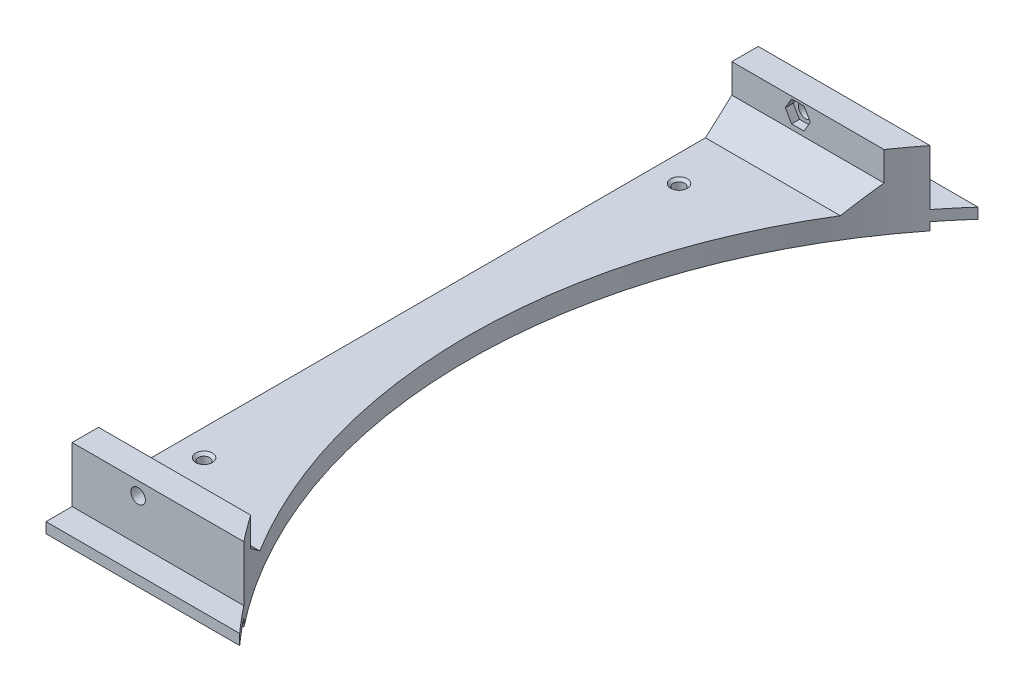
from build123d import *

# Parameters (mm, degrees)
SKETCH1_W                = 650
SKETCH1_H                = 650
BOSS_EXTRUDE1_DEPTH      = 8
BOSS_EXTRUDE2_DEPTH      = 650
CUT_EXTRUDE2_DEPTH       = 921.277302922
CUT_EXTRUDE2_DEPTH_BACK  = 921.277302922
SKETCH4_R                = 11
CUT_EXTRUDE1_DEPTH       = 920.932062709
CUT_EXTRUDE1_DEPTH_BACK  = 920.932062709
SKETCH2_R                = 210
CUT_EXTRUDE3_DEPTH       = 921.277302998
CUT_EXTRUDE3_DEPTH_BACK  = 110
CUT_EXTRUDE4_DEPTH       = 110
CUT_EXTRUDE5_DEPTH       = 920.932062713
CUT_EXTRUDE5_DEPTH_BACK  = 920.932062713
SKETCH7_OUTSIDE_W        = 836.056
SKETCH7_OUTSIDE_H        = 836.056
BOSS_EXTRUDE3_DEPTH      = 170
SKETCH11_W               = 9.9
SKETCH11_H               = 4
BOSS_EXTRUDE4_DEPTH      = 170
CUT_EXTRUDE7_DEPTH       = 496.410950626
CUT_EXTRUDE7_DEPTH_BACK  = 496.410950626
SKETCH10_R               = 210
CUT_EXTRUDE8_DEPTH       = 320.349035711
CUT_EXTRUDE8_DEPTH_BACK  = 320.349035711
SKETCH12_R               = 2.75
SKETCH12_R_2             = 2.2
CUT_EXTRUDE9_DEPTH       = 495.859380642
CUT_EXTRUDE9_DEPTH_BACK  = 495.859380642
SKETCH13_W               = 95
SKETCH13_H               = 279.8
CUT_EXTRUDE10_DEPTH      = 495.859380642
CUT_EXTRUDE10_DEPTH_BACK = 495.859380642
SKETCH14_R               = 2.15
CHAMFER1_SIZE            = 1
CUT_EXTRUDE11_DEPTH      = 3
LPATTERN1_COUNT          = 2
LPATTERN1_PITCH          = 243


with BuildPart() as part:
    # Sketch1 → Boss-Extrude1 (new body)
    with BuildSketch(Plane(origin=(0, 0, 0), x_dir=(1, 0, 0), z_dir=(0, 1, 0))):
        with Locations((325, 325)):
            Rectangle(SKETCH1_W, SKETCH1_H)
    extrude(amount=BOSS_EXTRUDE1_DEPTH)

    # Sketch3 → Boss-Extrude2 (add)
    with BuildSketch(Plane.XY):
        Polygon((300, 43.707142143), (350, 43.707142143), (385, 8), (265, 8), align=None)
    extrude(amount=-BOSS_EXTRUDE2_DEPTH)

    # Sketch4 → Cut-Extrude2 (cut, two sides: drawn at the far end of the back side and taken through both)
    with BuildSketch(Plane.XY.offset(-CUT_EXTRUDE2_DEPTH_BACK)):
        with Locations((325, 22)):
            Circle(SKETCH4_R)
    extrude(amount=CUT_EXTRUDE2_DEPTH + CUT_EXTRUDE2_DEPTH_BACK, mode=Mode.SUBTRACT)

    # Sketch2 → Cut-Extrude1 (cut, two sides: drawn at the far end of the back side and taken through both)
    with BuildSketch(Plane(origin=(0, 8, 0), x_dir=(1, 0, 0), z_dir=(0, 1, 0)).offset(-CUT_EXTRUDE1_DEPTH_BACK)):
        with Locations(Location((325, 325, 0), (0, 0, 270))):
            Circle(SKETCH2_R)
    extrude(amount=CUT_EXTRUDE1_DEPTH + CUT_EXTRUDE1_DEPTH_BACK, mode=Mode.SUBTRACT)

    # Sketch5 → Cut-Extrude3 (cut, two sides: drawn at the far end of the back side and taken through both)
    with BuildSketch(Plane.XY.offset(-CUT_EXTRUDE3_DEPTH_BACK)):
        Polygon((300, 43.707142143), (350, 43.707142143), (365.396078824, 28), (350, 28), (350, 8), (300, 8), (300, 28), (284.603921176, 28), align=None)
    extrude(amount=CUT_EXTRUDE3_DEPTH + CUT_EXTRUDE3_DEPTH_BACK, mode=Mode.SUBTRACT)

    # Sketch6 → Cut-Extrude4 (cut)
    with BuildSketch(Plane(origin=(0, 0, -650), x_dir=(-1, 0, 0), z_dir=(0, 0, -1))):
        Polygon((-350, 43.707142143), (-300, 43.707142143), (-284.603921176, 28), (-300, 28), (-300, 8), (-350, 8), (-350, 28), (-365.396078824, 28), align=None)
    extrude(amount=-CUT_EXTRUDE4_DEPTH, mode=Mode.SUBTRACT)

    # Sketch7 outside → Cut-Extrude5 (cut, two sides: drawn at the far end of the back side and taken through both)
    with BuildSketch(Plane(origin=(0, 8, 0), x_dir=(1, 0, 0), z_dir=(0, 1, 0)).offset(-CUT_EXTRUDE5_DEPTH_BACK)):
        with Locations((325, 325)):
            Rectangle(SKETCH7_OUTSIDE_W, SKETCH7_OUTSIDE_H)
        Polygon((195, 455), (-124.314954955, 455), (-40.613333333, 195), (195, 195), align=None, mode=Mode.SUBTRACT)
    extrude(amount=CUT_EXTRUDE5_DEPTH + CUT_EXTRUDE5_DEPTH_BACK, mode=Mode.SUBTRACT)

    # Sketch8 → Boss-Extrude3 (add)
    with BuildSketch(Plane.ZY):
        Polygon((-455, 8), (-455, 28), (-445, 28), (-445, 17), (-435, 8), align=None)
        Polygon((-195, 8), (-195, 28), (-205, 28), (-205, 17), (-215, 8), align=None)
    extrude(amount=-BOSS_EXTRUDE3_DEPTH)

    # Sketch11 → Boss-Extrude4 (add)
    with BuildSketch(Plane.ZY):
        with Locations((-459.95, 5)):
            Rectangle(SKETCH11_W, SKETCH11_H)
        with Locations((-190.05, 5)):
            Rectangle(SKETCH11_W, SKETCH11_H)
    extrude(amount=-BOSS_EXTRUDE4_DEPTH)

    # Sketch10 → Cut-Extrude7 (cut, two sides: drawn at the far end of the back side and taken through both)
    with BuildSketch(Plane(origin=(0, 8, 0), x_dir=(1, 0, 0), z_dir=(0, 1, 0)).offset(-CUT_EXTRUDE7_DEPTH_BACK)):
        with Locations((325, 325)):
            Circle(SKETCH10_R)
    extrude(amount=CUT_EXTRUDE7_DEPTH + CUT_EXTRUDE7_DEPTH_BACK, mode=Mode.SUBTRACT)

    # Sketch12 → Cut-Extrude8 (cut, two sides: drawn at the far end of the back side and taken through both)
    with BuildSketch(Plane.XY.offset(-195).offset(-CUT_EXTRUDE8_DEPTH_BACK)):
        with Locations((40, 23)):
            Circle(SKETCH12_R)
        with Locations((80, 23)):
            Circle(SKETCH12_R_2)
        with Locations((120, 23)):
            Circle(SKETCH12_R)
    extrude(amount=CUT_EXTRUDE8_DEPTH + CUT_EXTRUDE8_DEPTH_BACK, mode=Mode.SUBTRACT)

    # Sketch13 → Cut-Extrude9 (cut, two sides: drawn at the far end of the back side and taken through both)
    with BuildSketch(Plane(origin=(0, 8, 0), x_dir=(1, 0, 0), z_dir=(0, 1, 0)).offset(-CUT_EXTRUDE9_DEPTH_BACK)):
        with Locations((47.5, 325)):
            Rectangle(SKETCH13_W, SKETCH13_H)
    extrude(amount=CUT_EXTRUDE9_DEPTH + CUT_EXTRUDE9_DEPTH_BACK, mode=Mode.SUBTRACT)

    # Sketch14 → Cut-Extrude10 (cut, two sides: drawn at the far end of the back side and taken through both)
    with BuildSketch(Plane(origin=(0, 8, 0), x_dir=(1, 0, 0), z_dir=(0, 1, 0)).offset(-CUT_EXTRUDE10_DEPTH_BACK)):
        with Locations(Location((105, 235, 0), (0, 0, 270))):
            Circle(SKETCH14_R)
        with Locations(Location((105, 415, 0), (0, 0, 270))):
            Circle(SKETCH14_R)
    extrude(amount=CUT_EXTRUDE10_DEPTH + CUT_EXTRUDE10_DEPTH_BACK, mode=Mode.SUBTRACT)

    # Chamfer1
    chamfer1_edges = [part.edges().sort_by_distance(p)[0] for p in [
        (105, 8, -237.15),
        (105, 0, -417.15),
        (105, 8, -417.15),
    ]]
    chamfer(chamfer1_edges, length=CHAMFER1_SIZE)

    # Sketch15 → Cut-Extrude11 (cut)
    with BuildSketch(Plane(origin=(0, 0, -205), x_dir=(-1, 0, 0), z_dir=(0, 0, -1))):
        Polygon((-122.367136104, 27.1), (-117.632863896, 27.1), (-115.265727793, 23), (-117.632863896, 18.9), (-122.367136104, 18.9), (-124.734272207, 23), align=None)
    cut_extrude11 = extrude(amount=-CUT_EXTRUDE11_DEPTH, mode=Mode.SUBTRACT)

    # LPattern1: Cut-Extrude11 ×2
    with Locations(*[(0, 0, -i * LPATTERN1_PITCH) for i in range(1, LPATTERN1_COUNT)]):
        add(cut_extrude11, mode=Mode.SUBTRACT)


solid = part.part
